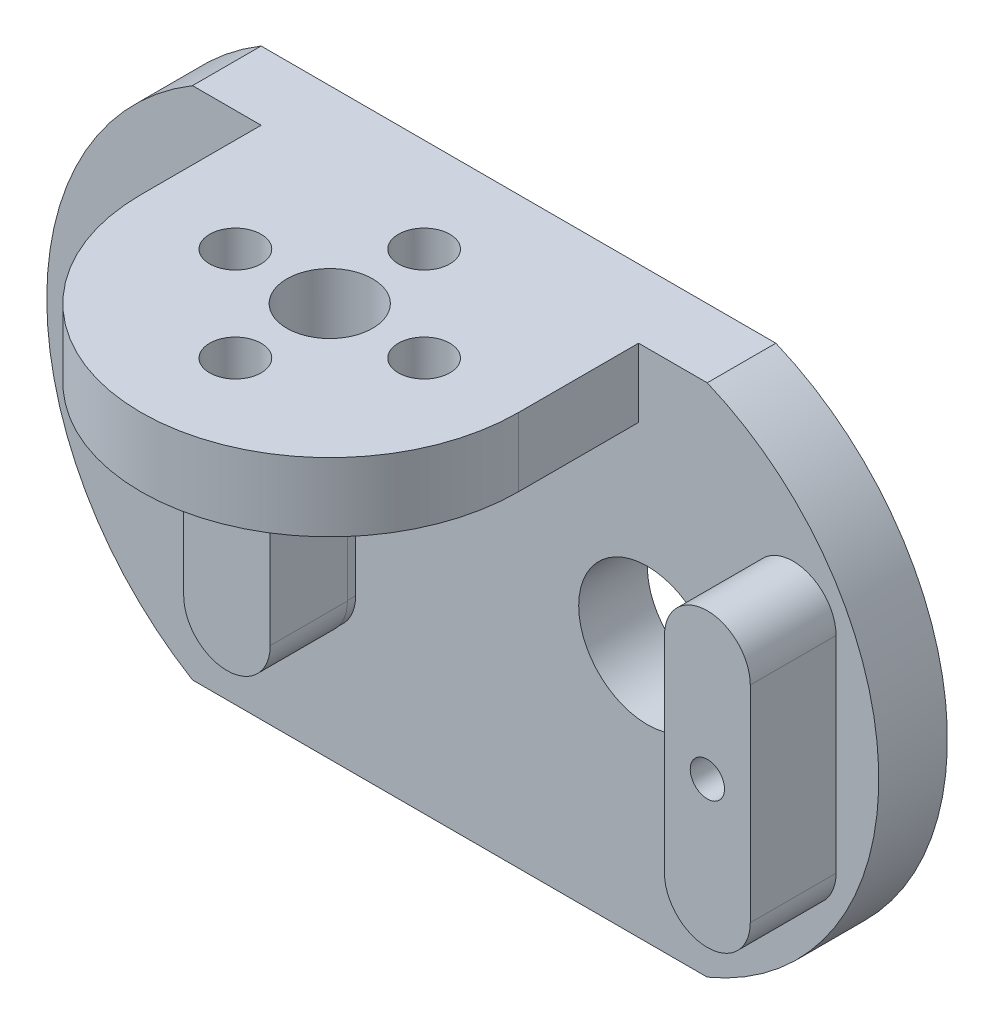
from build123d import *

# Parameters (mm, degrees)
SKETCH1_R               = 1
SKETCH1_R_2             = 1.75
BOSS_EXTRUDE1_DEPTH     = 4
SKETCH2_R               = 1
BOSS_EXTRUDE2_DEPTH     = 5
CUT_EXTRUDE1_DEPTH      = 30.580398915
CUT_EXTRUDE1_DEPTH_BACK = 30.580398915
SKETCH2_3_R             = 4
SKETCH4_W               = 22
SKETCH4_H               = 4
BOSS_EXTRUDE3_DEPTH     = 22
FILLET1_RADIUS          = 11
FILLET1_LENGTH          = 4
SKETCH5_R               = 2.5
SKETCH5_R_2             = 1.5
CUT_EXTRUDE2_DEPTH      = 22
SKETCH8_R               = 1.25
CUT_EXTRUDE4_DEPTH      = 4
BOSS_EXTRUDE4_START     = -4.5
SKETCH11_R              = 1
BOSS_EXTRUDE4_DEPTH     = 4.5


with BuildPart() as part:
    # Sketch1 → Boss-Extrude1 (new body)
    with BuildSketch(Plane.XY):
        with BuildLine():
            Line((-15, 15), (15, 15))
            ThreePointArc((15, 15), (25, 0), (15, -15))
            Line((15, -15), (-15, -15))
            ThreePointArc((-15, -15), (-23.492855685, 0), (-15, 15))
        make_face()
        with Locations((12.5, 0)):
            Circle(SKETCH1_R, mode=Mode.SUBTRACT)
        with Locations((-6, 0)):
            Circle(SKETCH1_R_2, mode=Mode.SUBTRACT)
        with Locations((-12.5, 0)):
            Circle(SKETCH1_R, mode=Mode.SUBTRACT)
    extrude(amount=BOSS_EXTRUDE1_DEPTH)

    # Sketch2 → Boss-Extrude2 (add)
    # profile 1 of 2: a face of its own
    with BuildSketch(Plane.XY.offset(4)):
        with BuildLine():
            Line((22.50880699, -6), (22.50880699, 6))
            ThreePointArc((22.50880699, 6), (20.00880699, 8.5), (17.50880699, 6))
            Line((17.50880699, 6), (17.50880699, -6))
            ThreePointArc((17.50880699, -6), (20.00880699, -8.5), (22.50880699, -6))
        make_face()
        with Locations((20.00880699, 0)):
            Circle(SKETCH2_R, mode=Mode.SUBTRACT)
    # profile 2 of 2: a face of its own
    with BuildSketch(Plane.XY.offset(4)):
        with BuildLine():
            Line((-5.49119301, 1.674400026), (-5.49119301, 6))
            ThreePointArc((-5.49119301, 6), (-7.99119301, 8.5), (-10.49119301, 6))
            Line((-10.49119301, 6), (-10.49119301, -6))
            ThreePointArc((-10.49119301, -6), (-7.99119301, -8.5), (-5.49119301, -6))
            Line((-5.49119301, -6), (-5.49119301, -1.674400026))
            ThreePointArc((-5.49119301, -1.674400026), (-6.640863596, -1.628432944), (-7.5135021, -0.87852797))
            ThreePointArc((-7.5135021, -0.87852797), (-8.99119301, 0), (-7.5135021, 0.87852797))
            ThreePointArc((-7.5135021, 0.87852797), (-6.640863596, 1.628432944), (-5.49119301, 1.674400026))
        make_face()
    extrude(amount=BOSS_EXTRUDE2_DEPTH)

    # Sketch2<3> → Cut-Extrude1 (cut, two sides: drawn at the far end of the back side and taken through both)
    with BuildSketch(Plane.XY.offset(4).offset(-CUT_EXTRUDE1_DEPTH_BACK)):
        with Locations((11.50880699, 0)):
            Circle(SKETCH2_3_R)
    extrude(amount=CUT_EXTRUDE1_DEPTH + CUT_EXTRUDE1_DEPTH_BACK, mode=Mode.SUBTRACT)

    # Sketch4 → Boss-Extrude3 (add)
    with BuildSketch(Plane(origin=(0, 0, 0), x_dir=(-1, 0, 0), z_dir=(0, 0, -1))):
        with Locations((0, 13)):
            Rectangle(SKETCH4_W, SKETCH4_H)
    extrude(amount=-BOSS_EXTRUDE3_DEPTH)

    # Fillet1: full round fillet: the end face becomes a half cylinder, R = half its width
    fillet1_face = Plane((0, 13, 22), x_dir=(0, 1, 0), z_dir=(0, 0, 1))  # on the end face: x along it, z out of the body
    fillet1_slab = fillet1_face.offset(-FILLET1_RADIUS / 2) * Box(FILLET1_LENGTH, 2 * FILLET1_RADIUS, FILLET1_RADIUS, mode=Mode.PRIVATE)  # the body's end, R deep
    fillet1_round = Plane((0, 13, 11), x_dir=(0, 0, 1), z_dir=(0, 1, 0)) * Cylinder(FILLET1_RADIUS, FILLET1_LENGTH, mode=Mode.PRIVATE)  # its axis R under the face
    add(fillet1_slab - fillet1_round, mode=Mode.SUBTRACT)

    # Sketch5 → Cut-Extrude2 (cut)
    with BuildSketch(Plane(origin=(0, 15, 0), x_dir=(1, 0, 0), z_dir=(0, 1, 0))):
        with Locations(Location((0, -11, 0), (0, 0, 180))):
            Circle(SKETCH5_R)
        with Locations(Location((-5.5, -11, 0), (0, 0, 180))):
            Circle(SKETCH5_R_2)
        with Locations(Location((0, -5.5, 0), (0, 0, 180))):
            Circle(SKETCH5_R_2)
        with Locations(Location((5.5, -11, 0), (0, 0, 180))):
            Circle(SKETCH5_R_2)
        with Locations(Location((0, -16.5, 0), (0, 0, 180))):
            Circle(SKETCH5_R_2)
    extrude(amount=-CUT_EXTRUDE2_DEPTH, mode=Mode.SUBTRACT)

    # Sketch8 → Cut-Extrude4 (cut)
    with BuildSketch(Plane(origin=(0, 0, 0), x_dir=(-1, 0, 0), z_dir=(0, 0, -1))):
        with Locations((-19, 0)):
            Circle(SKETCH8_R)
    extrude(amount=-CUT_EXTRUDE4_DEPTH, mode=Mode.SUBTRACT)

    # Sketch11 → Boss-Extrude4 (add)
    with BuildSketch(Plane.XY.offset(9).offset(BOSS_EXTRUDE4_START)):
        with BuildLine():
            Line((-10.512429322, -6), (-10.512429322, 6))
            ThreePointArc((-10.512429322, 6), (-7.99119301, 8.521236312), (-5.469956698, 6))
            Line((-5.469956698, 6), (-5.469956698, -6))
            ThreePointArc((-5.469956698, -6), (-7.99119301, -8.521236312), (-10.512429322, -6))
        make_face()
        with Locations(Location((-7.99119301, 0, 0), (0, 0, 298.53470001))):
            Circle(SKETCH11_R, mode=Mode.SUBTRACT)
    extrude(amount=BOSS_EXTRUDE4_DEPTH)


solid = part.part
